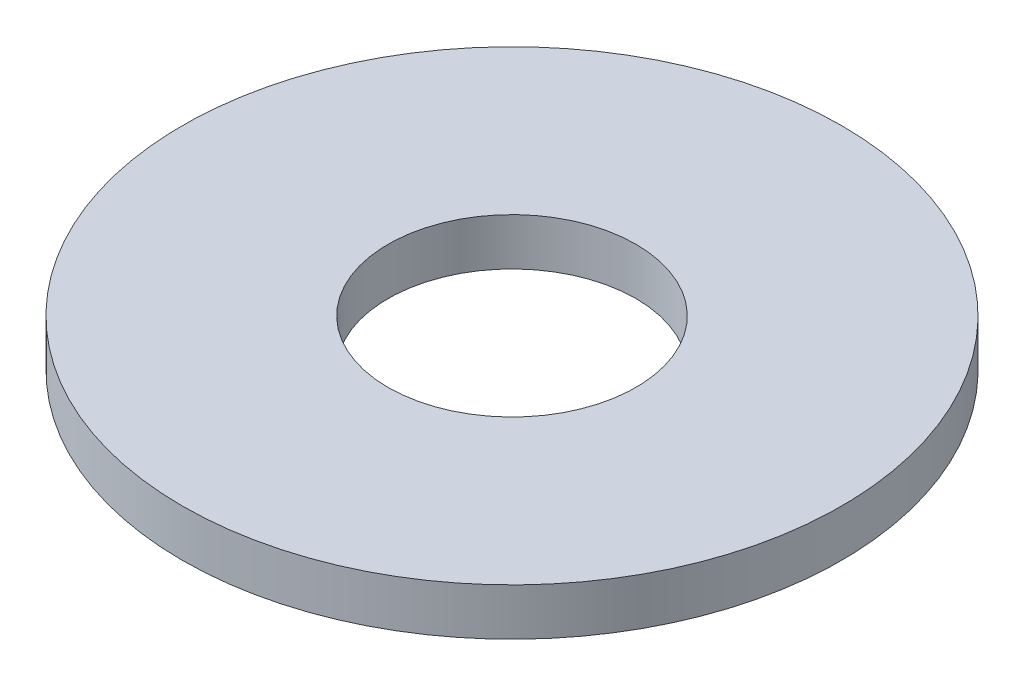
from build123d import *

# Parameters (mm, degrees)
SKETCH1_R           = 2.667
SKETCH1_R_2         = 1.0033
BOSS_EXTRUDE1_DEPTH = 0.381


with BuildPart() as part:
    # Sketch1 → Boss-Extrude1 (new body)
    with BuildSketch(Plane(origin=(0, 0, 0), x_dir=(1, 0, 0), z_dir=(0, 1, 0))):
        with Locations(Location((0, 0, 0), (0, 0, 90))):
            Circle(SKETCH1_R)
        with Locations(Location((0, 0, 0), (0, 0, 90))):
            Circle(SKETCH1_R_2, mode=Mode.SUBTRACT)
    extrude(amount=BOSS_EXTRUDE1_DEPTH)


solid = part.part
